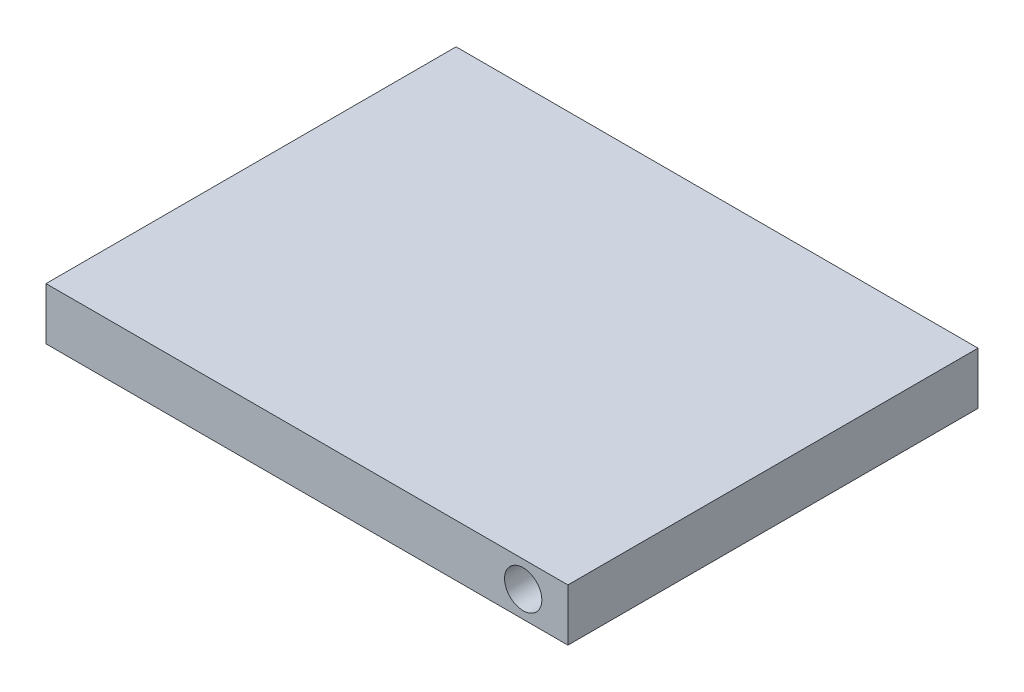
from build123d import *

# Parameters (mm, degrees)
SKETCH1_W           = 70
SKETCH1_H           = 55
BOSS_EXTRUDE1_DEPTH = 7
CUT_EXTRUDE1_DEPTH  = 100


with BuildPart() as part:
    # Sketch1 → Boss-Extrude1 (new body)
    with BuildSketch(Plane(origin=(0, 0, 0), x_dir=(1, 0, 0), z_dir=(0, 1, 0))):
        with Locations((35, 27.5)):
            Rectangle(SKETCH1_W, SKETCH1_H)
    extrude(amount=BOSS_EXTRUDE1_DEPTH)

    # Sketch2 → Cut-Extrude1 (cut)
    with BuildSketch(Plane(origin=(0, 0, -55), x_dir=(-1, 0, 0), z_dir=(0, 0, -1))):
        with BuildLine():
            ThreePointArc((-61.5, 3.5), (-62.232233047, 5.267766953), (-64, 6))
            Line((-64, 6), (-64, 1))
            ThreePointArc((-64, 1), (-62.232233047, 1.732233047), (-61.5, 3.5))
        make_face()
        with BuildLine():
            Line((-64, 1), (-64, 6))
            ThreePointArc((-64, 6), (-66.5, 3.5), (-64, 1))
        make_face()
    extrude(amount=-CUT_EXTRUDE1_DEPTH, mode=Mode.SUBTRACT)


solid = part.part
